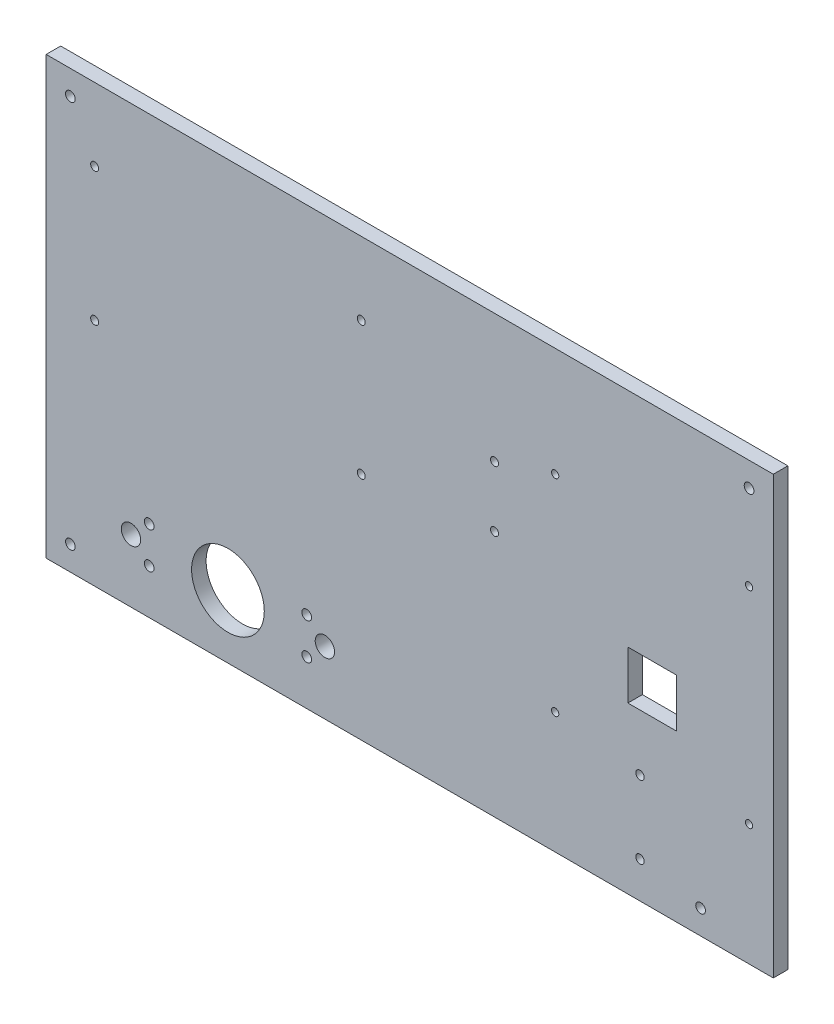
from build123d import *

# Parameters (mm, degrees)
ESBO_O1_W                = 300
ESBO_O1_H                = 180
ESBO_O1_R                = 1.5
ESBO_O1_R_2              = 2
ESBO_O1_R_3              = 15
ESBO_O1_R_4              = 4
ESBO_O1_R_5              = 1.65
ESBO_O1_R_6              = 1.75
ESBO_O1_W_2              = 20
ESBO_O1_H_2              = 20
RESSALTO_EXTRUS_O1_DEPTH = 6
ESBO_O2_R                = 2
CORTE_EXTRUS_O1_DEPTH    = 10


with BuildPart() as part:
    # Esboço1 → Ressalto-extrusão1 (new body)
    with BuildSketch(Plane.XY):
        Rectangle(ESBO_O1_W, ESBO_O1_H)
        with Locations((140, 45)):
            Circle(ESBO_O1_R, mode=Mode.SUBTRACT)
        with Locations((140, -40)):
            Circle(ESBO_O1_R, mode=Mode.SUBTRACT)
        with Locations((60, -40)):
            Circle(ESBO_O1_R, mode=Mode.SUBTRACT)
        with Locations((60, 45)):
            Circle(ESBO_O1_R, mode=Mode.SUBTRACT)
        with Locations((-107.5, -56.5)):
            Circle(ESBO_O1_R_2, mode=Mode.SUBTRACT)
        with Locations((-42.5, -56.5)):
            Circle(ESBO_O1_R_2, mode=Mode.SUBTRACT)
        with Locations((-75, -64)):
            Circle(ESBO_O1_R_3, mode=Mode.SUBTRACT)
        with Locations((-35, -64)):
            Circle(ESBO_O1_R_4, mode=Mode.SUBTRACT)
        with Locations((-115, -64)):
            Circle(ESBO_O1_R_4, mode=Mode.SUBTRACT)
        with Locations((-42.5, -71.5)):
            Circle(ESBO_O1_R_2, mode=Mode.SUBTRACT)
        with Locations((-107.5, -71.5)):
            Circle(ESBO_O1_R_2, mode=Mode.SUBTRACT)
        with Locations((35, 37)):
            Circle(ESBO_O1_R_5, mode=Mode.SUBTRACT)
        with Locations((35, 12)):
            Circle(ESBO_O1_R_5, mode=Mode.SUBTRACT)
        with Locations((-130, 60)):
            Circle(ESBO_O1_R_5, mode=Mode.SUBTRACT)
        with Locations((-20, 60)):
            Circle(ESBO_O1_R_5, mode=Mode.SUBTRACT)
        with Locations((-20, 5)):
            Circle(ESBO_O1_R_5, mode=Mode.SUBTRACT)
        with Locations((-130, 5)):
            Circle(ESBO_O1_R_5, mode=Mode.SUBTRACT)
        with Locations((95, -45)):
            Circle(ESBO_O1_R_6, mode=Mode.SUBTRACT)
        with Locations((95, -75)):
            Circle(ESBO_O1_R_6, mode=Mode.SUBTRACT)
        with Locations((100, -11.75)):
            Rectangle(ESBO_O1_W_2, ESBO_O1_H_2, mode=Mode.SUBTRACT)
    extrude(amount=RESSALTO_EXTRUS_O1_DEPTH)

    # Esboço2 → Corte-extrusão1 (cut)
    with BuildSketch(Plane.XY.offset(6)):
        with Locations((-140, 80)):
            Circle(ESBO_O2_R)
        with Locations((140, 80)):
            Circle(ESBO_O2_R)
        with Locations((120, -80)):
            Circle(ESBO_O2_R)
        with Locations((-140, -80)):
            Circle(ESBO_O2_R)
    extrude(amount=-CORTE_EXTRUS_O1_DEPTH, mode=Mode.SUBTRACT)


solid = part.part
